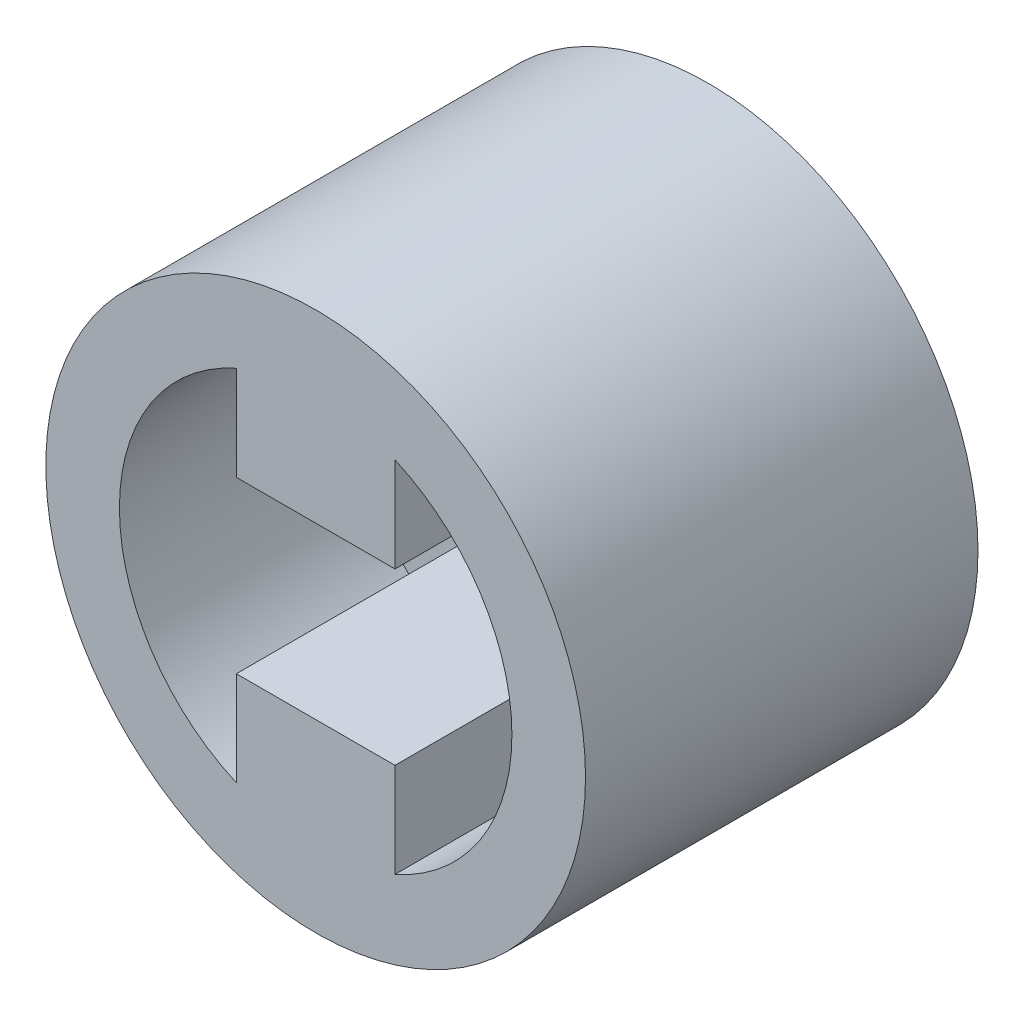
from build123d import *

# Parameters (mm, degrees)
SKETCH1_R           = 8.25
BOSS_EXTRUDE1_DEPTH = 12
CUT_EXTRUDE1_DEPTH  = 7
CUT_EXTRUDE2_DEPTH  = 17.736935203


with BuildPart() as part:
    # Sketch1 → Boss-Extrude1 (new body)
    with BuildSketch(Plane.XY):
        Circle(SKETCH1_R)
    extrude(amount=BOSS_EXTRUDE1_DEPTH)

    # Sketch2 → Cut-Extrude1 (cut)
    with BuildSketch(Plane.XY.offset(12)):
        with BuildLine():
            Line((-2.425, 2.6), (-2.425, 5.488112153))
            ThreePointArc((-2.425, 5.488112153), (-6, 0), (-2.425, -5.488112153))
            Line((-2.425, -5.488112153), (-2.425, -2.6))
            Line((-2.425, -2.6), (2.425, -2.6))
            Line((2.425, -2.6), (2.425, -5.488112153))
            ThreePointArc((2.425, -5.488112153), (5.027424788, -3.274904579), (6, 0))
            ThreePointArc((6, 0), (5.027424788, 3.274904579), (2.425, 5.488112153))
            Line((2.425, 5.488112153), (2.425, 2.6))
            Line((2.425, 2.6), (-2.425, 2.6))
        make_face()
    extrude(amount=-CUT_EXTRUDE1_DEPTH, mode=Mode.SUBTRACT)

    # Sketch3 → Cut-Extrude2 (cut, through all)
    with BuildSketch(Plane(origin=(0, 0, 0), x_dir=(-1, 0, 0), z_dir=(0, 0, -1))):
        Polygon((2.309401077, 0), (1.154700538, 2), (-1.154700538, 2), (-2.309401077, 0), (-1.154700538, -2), (1.154700538, -2), align=None)
    extrude(amount=-CUT_EXTRUDE2_DEPTH, mode=Mode.SUBTRACT)


solid = part.part
